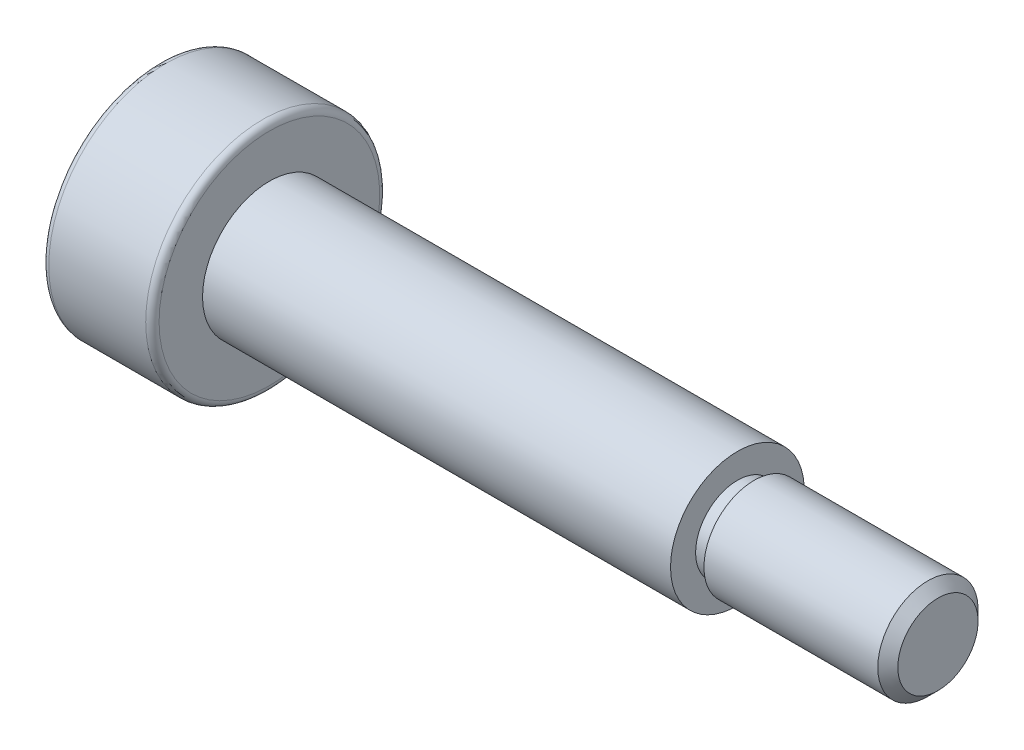
from build123d import *

# Parameters (mm, degrees)
FILLET_1_R          = 0.2
CHAMFER_1_SIZE      = 0.3
SKETCH_3_W          = 0.5
SKETCH_3_H          = 0.25
CUT_EXTRUDE_1_DEPTH = 2


with BuildPart() as part:
    # 草图1 → 旋转1 (revolve)
    with BuildSketch(Plane.XY, mode=Mode.PRIVATE) as revolve_1_sk:
        Polygon((-11.65, 0), (-11.65, 3.5), (-8.35, 3.5), (-8.35, 2), (5.65, 2), (5.65, 1.5), (11.65, 1.5), (11.65, 0), align=None)
    revolve(revolve_1_sk.sketch.rotate(Axis((-11.65, 0, 0), (1, 0, 0)), 90), axis=Axis((-11.65, 0, 0), (1, 0, 0)))

    # 圆角1
    fillet_1_edges = [part.edges().sort_by_distance(p)[0] for p in [
        (-8.35, 0, -3.5),
        (-11.65, 0, -3.5),
    ]]
    fillet(fillet_1_edges, radius=FILLET_1_R)

    # 倒角1
    chamfer_1_edges = [part.edges().sort_by_distance(p)[0] for p in [
        (11.65, 0, -1.5),
    ]]
    chamfer(chamfer_1_edges, length=CHAMFER_1_SIZE)

    # 草图3 → 切除-旋转1 (revolve, cut)
    with BuildSketch(Plane.XY, mode=Mode.PRIVATE) as cut_revolve_1_sk:
        with Locations((5.9, 1.375)):
            Rectangle(SKETCH_3_W, SKETCH_3_H)
    revolve(cut_revolve_1_sk.sketch.rotate(Axis((5.65, 0, 0), (1, 0, 0)), 90), axis=Axis((5.65, 0, 0), (1, 0, 0)), mode=Mode.SUBTRACT)

    # 草图4 → 切除-拉伸1 (cut)
    with BuildSketch(Plane.ZY.offset(11.65)):
        Polygon((1.732050808, 0), (0.866025404, 1.5), (-0.866025404, 1.5), (-1.732050808, 0), (-0.866025404, -1.5), (0.866025404, -1.5), align=None)
    extrude(amount=-CUT_EXTRUDE_1_DEPTH, mode=Mode.SUBTRACT)


solid = part.part
